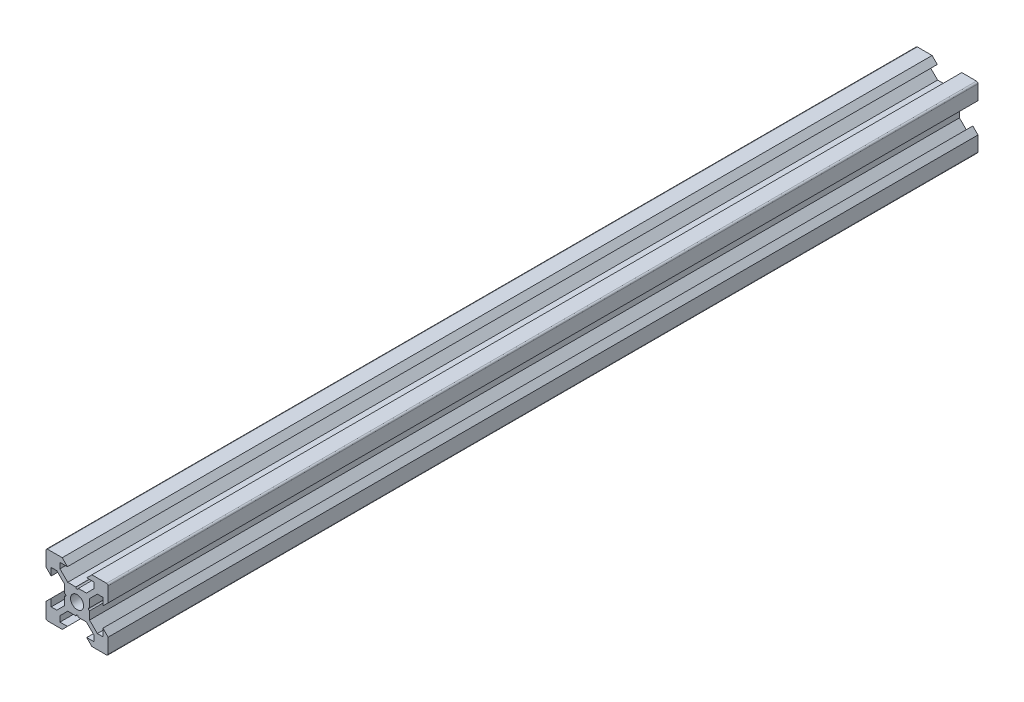
from build123d import *

# Parameters (mm, degrees)
SKETCH1_R           = 2.1
BOSS_EXTRUDE1_DEPTH = 280
FILLET1_R           = 0.5
CUT_EXTRUDE1_DEPTH  = 281.356915378


with BuildPart() as part:
    # Sketch1 → Boss-Extrude1 (new body)
    with BuildSketch(Plane.XY):
        Polygon((-10, 10), (-4.775, 10), (-3.1, 8.325), (-5.5, 8.325), (-5.5, 6.525), (-3, 4.025), (3, 4.025), (5.5, 6.525), (5.5, 8.325), (3.1, 8.325), (4.775, 10), (10, 10), (10, 4.775), (8.325, 3.1), (8.325, 5.5), (6.525, 5.5), (4.025, 3), (4.025, -3), (6.525, -5.5), (8.325, -5.5), (8.325, -3.1), (10, -4.775), (10, -10), (4.775, -10), (3.1, -8.325), (5.5, -8.325), (5.5, -6.525), (3, -4.025), (-3, -4.025), (-5.5, -6.525), (-5.5, -8.325), (-3.1, -8.325), (-4.775, -10), (-10, -10), (-10, -4.775), (-8.325, -3.1), (-8.325, -5.5), (-6.525, -5.5), (-4.025, -3), (-4.025, 3), (-6.525, 5.5), (-8.325, 5.5), (-8.325, 3.1), (-10, 4.775), align=None)
        Circle(SKETCH1_R, mode=Mode.SUBTRACT)
    extrude(amount=BOSS_EXTRUDE1_DEPTH)

    # Fillet1
    fillet1_edges = [part.edges().sort_by_distance(p)[0] for p in [
        (10, -10, 140),
        (-10, -10, 140),
        (-10, 10, 140),
        (10, 10, 140),
    ]]
    fillet(fillet1_edges, radius=FILLET1_R)

    # Sketch2 → Cut-Extrude1 (cut, through all)
    with BuildSketch(Plane.XY.offset(280)):
        with BuildLine():
            ThreePointArc((-4.025, 0.4), (-4.425, 0), (-4.025, -0.4))
            Line((-4.025, -0.4), (-4.025, 0.4))
        make_face()
        with BuildLine():
            Line((-4.025, 0.4), (-4.025, -0.4))
            ThreePointArc((-4.025, -0.4), (-3.742157288, -0.282842712), (-3.625, 0))
            ThreePointArc((-3.625, 0), (-3.742157288, 0.282842712), (-4.025, 0.4))
        make_face()
        with BuildLine():
            ThreePointArc((0.4, 4.025), (0, 4.425), (-0.4, 4.025))
            Line((-0.4, 4.025), (0.4, 4.025))
        make_face()
        with BuildLine():
            Line((0.4, 4.025), (-0.4, 4.025))
            ThreePointArc((-0.4, 4.025), (0, 3.625), (0.4, 4.025))
        make_face()
        with BuildLine():
            ThreePointArc((4.025, 0.4), (3.625, 0), (4.025, -0.4))
            Line((4.025, -0.4), (4.025, 0.4))
        make_face()
        with BuildLine():
            Line((4.025, 0.4), (4.025, -0.4))
            ThreePointArc((4.025, -0.4), (4.307842712, -0.282842712), (4.425, 0))
            ThreePointArc((4.425, 0), (4.307842712, 0.282842712), (4.025, 0.4))
        make_face()
        with BuildLine():
            ThreePointArc((0.4, -4.025), (0, -3.625), (-0.4, -4.025))
            Line((-0.4, -4.025), (0.4, -4.025))
        make_face()
        with BuildLine():
            Line((0.4, -4.025), (-0.4, -4.025))
            ThreePointArc((-0.4, -4.025), (0, -4.425), (0.4, -4.025))
        make_face()
    extrude(amount=-CUT_EXTRUDE1_DEPTH, mode=Mode.SUBTRACT)


solid = part.part
